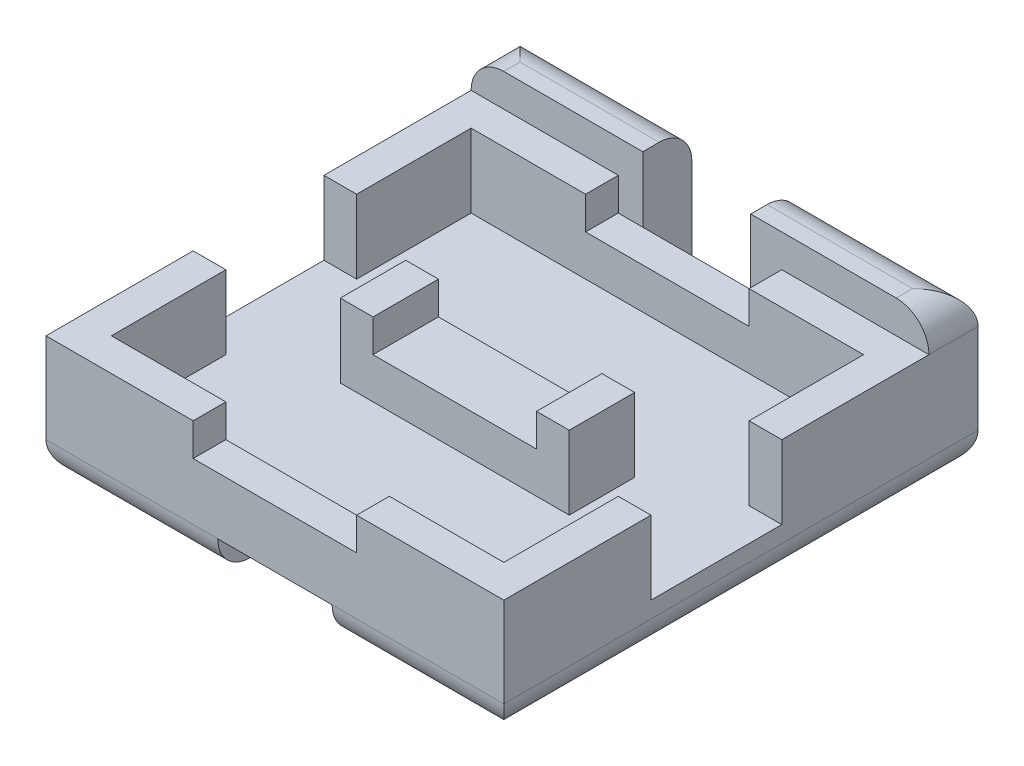
from build123d import *

# Parameters (mm, degrees)
BOSS_EXTRUDE1_DEPTH = 13
SKETCH2_W           = 12.000442616
SKETCH2_H           = 1
BOSS_EXTRUDE2_DEPTH = 2.25
CUT_EXTRUDE2_REACH  = 25.453
SKETCH5_W           = 4
SKETCH5_H           = 2.25
SKETCH6_W           = 7
SKETCH6_H           = 2
BOSS_EXTRUDE4_DEPTH = 2.25
SKETCH4_W           = 5
SKETCH4_H           = 1
CUT_EXTRUDE1_DEPTH  = 21.076474399
SKETCH7_W           = 5.25
SKETCH7_H           = 4.75
SKETCH7_W_2         = 5.45
BOSS_EXTRUDE5_DEPTH = 1.5
FILLET5_R           = 1
FILLET6_R           = 1


with BuildPart() as part:
    # Sketch1 → Boss-Extrude1 (new body)
    with BuildSketch(Plane.XY):
        Polygon((-7, -13.603853288), (-1.75, -13.603853288), (-1.75, -12.603853288), (1.75, -12.603853288), (1.75, -13.603853288), (7, -13.603853288), (7, -12.103853288), (7, -9.853853288), (6.000442616, -9.853853288), (6.000442616, -12.103853288), (-6, -12.103853288), (-6, -9.853853288), (-7, -9.853853288), (-7, -12.103853288), align=None)
    extrude(amount=BOSS_EXTRUDE1_DEPTH)

    # Sketch2 → Boss-Extrude2 (add)
    with BuildSketch(Plane(origin=(0, -12.103853288, 0), x_dir=(1, 0, 0), z_dir=(0, 1, 0))):
        with Locations((0.000221308, -0.5)):
            Rectangle(SKETCH2_W, SKETCH2_H)
        with Locations((0.000221308, -12.5)):
            Rectangle(SKETCH2_W, SKETCH2_H)
    extrude(amount=BOSS_EXTRUDE2_DEPTH)

    # Cut-Extrude2: up to this face of the body (flat: up to its plane)
    cut_extrude2_end = Plane(part.part.faces().sort_by_distance((7, -11.728853288, 6.5))[0])
    # Sketch5 → Cut-Extrude2 (cut, up to the picked face)
    with BuildSketch(Plane.ZY.offset(7), mode=Mode.PRIVATE) as cut_extrude2_sk1:
        with Locations((6.5, -10.978853288)):
            Rectangle(SKETCH5_W, SKETCH5_H)
    cut_extrude2_tool1 = split(extrude(cut_extrude2_sk1.sketch, amount=-CUT_EXTRUDE2_REACH, mode=Mode.PRIVATE), bisect_by=cut_extrude2_end, keep=Keep.BOTH, mode=Mode.PRIVATE)
    add(cut_extrude2_tool1.solids().sort_by(Axis((-7, -10.978853, 6.5), (1, 0, 0)))[0], mode=Mode.SUBTRACT)

    # Sketch6 → Boss-Extrude4 (add)
    with BuildSketch(Plane(origin=(0, -12.103853288, 0), x_dir=(1, 0, 0), z_dir=(0, 1, 0))):
        with Locations((0, -6.5)):
            Rectangle(SKETCH6_W, SKETCH6_H)
    extrude(amount=BOSS_EXTRUDE4_DEPTH)

    # Sketch4 → Cut-Extrude1 (cut, through all)
    with BuildSketch(Plane(origin=(0, 0, 0), x_dir=(-1, 0, 0), z_dir=(0, 0, -1))):
        with Locations((0, -10.353853288)):
            Rectangle(SKETCH4_W, SKETCH4_H)
    extrude(amount=-CUT_EXTRUDE1_DEPTH, mode=Mode.SUBTRACT)

    # Sketch7 → Boss-Extrude5 (add)
    with BuildSketch(Plane(origin=(0, 0, 0), x_dir=(-1, 0, 0), z_dir=(0, 0, -1))):
        with Locations((4.375, -11.228853288)):
            Rectangle(SKETCH7_W, SKETCH7_H)
        with Locations((-4.275, -11.228853288)):
            Rectangle(SKETCH7_W_2, SKETCH7_H)
    extrude(amount=BOSS_EXTRUDE5_DEPTH)

    # Fillet5
    fillet5_edges = [part.edges().sort_by_distance(p)[0] for p in [
        (4.375, -13.603853288, 13),
        (-4.375, -13.603853288, -1.5),
        (-4.375, -13.603853288, 13),
        (-7, -13.603853288, 5.75),
        (7, -13.603853288, 5.75),
        (4.275, -13.603853288, -1.5),
    ]]
    fillet(fillet5_edges, radius=FILLET5_R)

    # Fillet6
    fillet6_edges = [part.edges().sort_by_distance(p)[0] for p in [
        (-7, -8.853853288, -0.75),
        (7, -8.853853288, -0.75),
        (-4.375, -8.853853288, -1.5),
        (4.275, -8.853853288, -1.5),
    ]]
    fillet(fillet6_edges, radius=FILLET6_R)


solid = part.part
